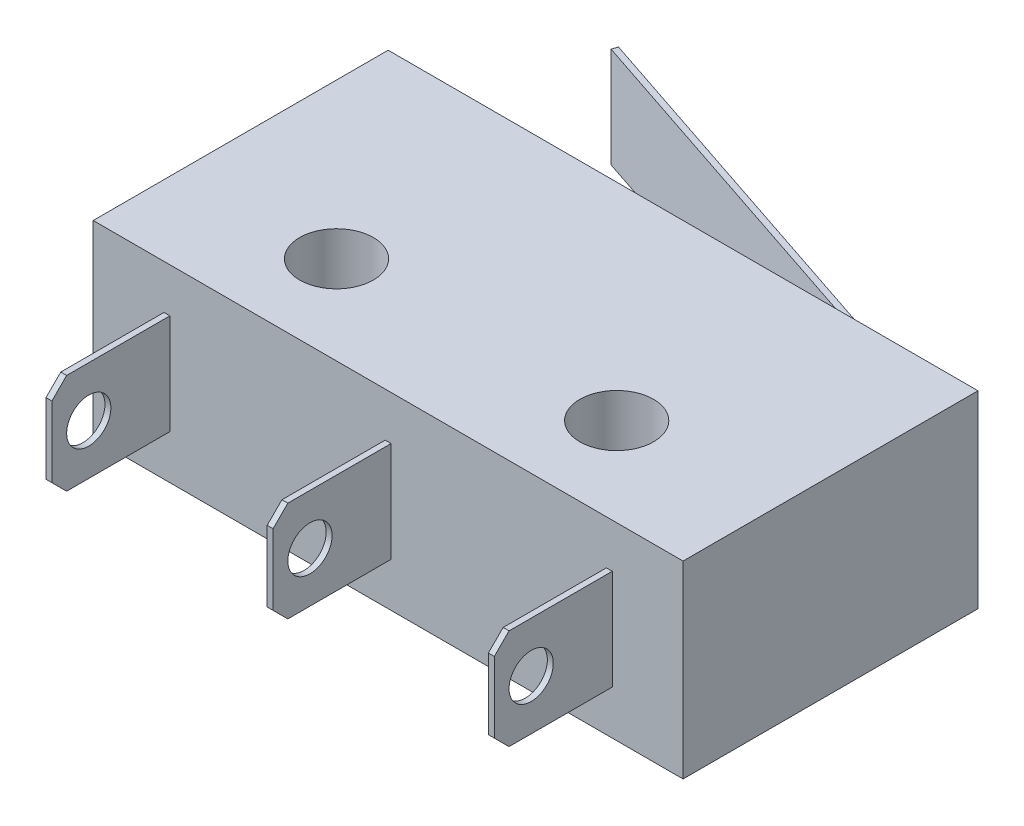
from build123d import *

# Parameters (mm, degrees)
SKETCH1_R           = 1.25
BOSS_EXTRUDE1_DEPTH = 6.4
BOSS_EXTRUDE2_START = 1.5
SKETCH1_3_W         = 0.2
SKETCH1_3_H         = 4
BOSS_EXTRUDE2_DEPTH = 3.4
CHAMFER2_SIZE       = 0.5
SKETCH3_R           = 0.75
CUT_EXTRUDE2_DEPTH  = 20.4


with BuildPart() as part:
    # Sketch1 → Boss-Extrude1 (new body)
    with BuildSketch(Plane(origin=(0, 0, 0), x_dir=(1, 0, 0), z_dir=(0, 1, 0))):
        Polygon((10, 5), (7.3, 5), (7.1, 5), (4.5, 5), (2.5, 5), (-10, 5), (-10, -5), (-7.6, -5), (-7.4, -5), (-0.1, -5), (0.1, -5), (7.4, -5), (7.6, -5), (10, -5), align=None)
        with Locations((-4.75, -2)):
            Circle(SKETCH1_R, mode=Mode.SUBTRACT)
        with Locations((4.75, -2)):
            Circle(SKETCH1_R, mode=Mode.SUBTRACT)
    extrude(amount=BOSS_EXTRUDE1_DEPTH)

    # Sketch1<3> → Boss-Extrude2 (add)
    with BuildSketch(Plane(origin=(0, 0, 0), x_dir=(1, 0, 0), z_dir=(0, 1, 0)).offset(BOSS_EXTRUDE2_START)):
        Polygon((7.1, 5), (7.3, 5), (7.3, 5.5), (-7.687995196, 10.5), (-7.751286335, 10.310278542), (7.1, 5.355884662), align=None)
        with BuildLine():
            Line((2.5, 5), (4.5, 5))
            Line((4.5, 5), (4.5, 5.5))
            ThreePointArc((4.5, 5.5), (3.5, 6.5), (2.5, 5.5))
            Line((2.5, 5.5), (2.5, 5))
        make_face()
        with Locations((7.5, -7)):
            Rectangle(SKETCH1_3_W, SKETCH1_3_H)
        with Locations((0, -7)):
            Rectangle(SKETCH1_3_W, SKETCH1_3_H)
        with Locations((-7.5, -7)):
            Rectangle(SKETCH1_3_W, SKETCH1_3_H)
    extrude(amount=BOSS_EXTRUDE2_DEPTH)

    # Chamfer2
    chamfer2_edges = [part.edges().sort_by_distance(p)[0] for p in [
        (7.5, 1.5, 9),
        (7.5, 4.9, 9),
        (0, 1.5, 9),
        (0, 4.9, 9),
        (-7.5, 1.5, 9),
        (-7.5, 4.9, 9),
    ]]
    chamfer(chamfer2_edges, length=CHAMFER2_SIZE)

    # Sketch3 → Cut-Extrude2 (cut)
    with BuildSketch(Plane.ZY.offset(7.6)):
        with Locations((7.75, 3.2)):
            Circle(SKETCH3_R)
    extrude(amount=-CUT_EXTRUDE2_DEPTH, mode=Mode.SUBTRACT)


solid = part.part
